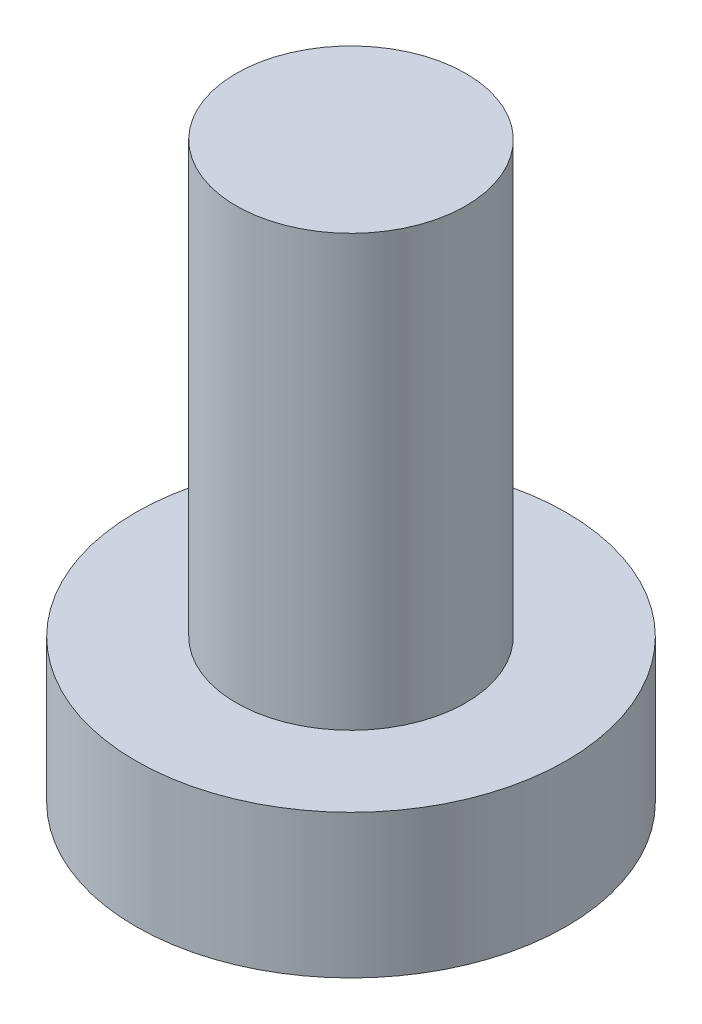
from build123d import *


with BuildPart() as part:
    # Sketch1 → Revolve1 (revolve)
    with BuildSketch(Plane.XY, mode=Mode.PRIVATE) as revolve1_sk:
        Polygon((0, 0), (0, 20), (4, 20), (4, 5), (7.5, 5), (7.5, 0), align=None)
    revolve(revolve1_sk.sketch.rotate(Axis((0, 0, 0), (0, 1, 0)), 90), axis=Axis((0, 0, 0), (0, 1, 0)))


solid = part.part
